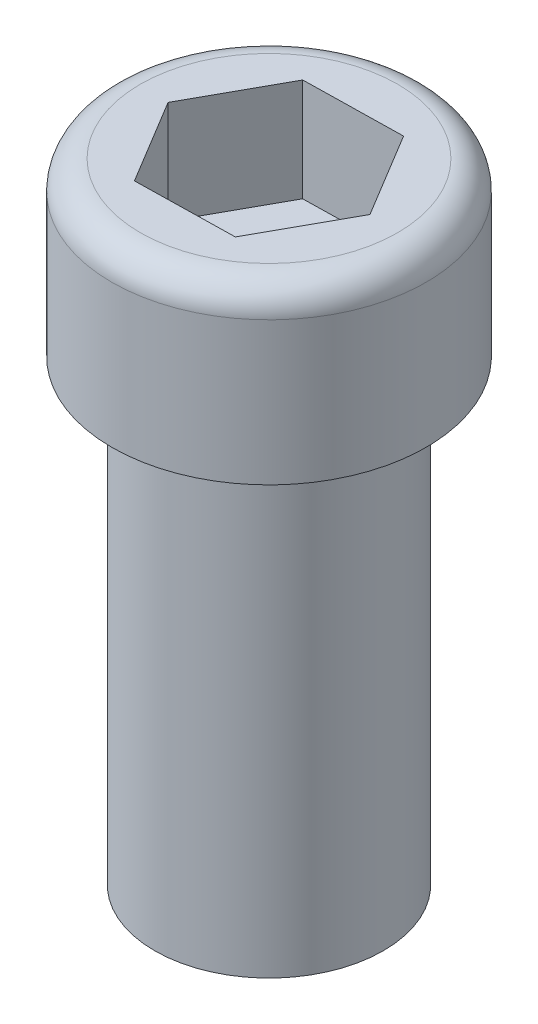
from build123d import *

# Parameters (mm, degrees)
SKETCH1_R           = 2
BOSS_EXTRUDE1_DEPTH = 8
SKETCH2_R           = 2.75
BOSS_EXTRUDE2_DEPTH = 3
CUT_EXTRUDE1_DEPTH  = 1.8
FILLET1_R           = 0.5


with BuildPart() as part:
    # Sketch1 → Boss-Extrude1 (new body)
    with BuildSketch(Plane(origin=(0, 0, 0), x_dir=(1, 0, 0), z_dir=(0, 1, 0))):
        with Locations(Location((0, 0, 0), (0, 0, 270))):
            Circle(SKETCH1_R)
    extrude(amount=BOSS_EXTRUDE1_DEPTH)

    # Sketch2 → Boss-Extrude2 (add)
    with BuildSketch(Plane(origin=(0, 8, 0), x_dir=(1, 0, 0), z_dir=(0, 1, 0))):
        with Locations(Location((0, 0, 0), (0, 0, 270))):
            Circle(SKETCH2_R)
    extrude(amount=BOSS_EXTRUDE2_DEPTH)

    # Sketch3 → Cut-Extrude1 (cut)
    with BuildSketch(Plane(origin=(0, 11, 0), x_dir=(1, 0, 0), z_dir=(0, 1, 0))):
        Polygon((0.837254289, 1.516247096), (-0.894481359, 1.483207031), (-1.731735648, -0.033040065), (-0.837254289, -1.516247096), (0.894481359, -1.483207031), (1.731735648, 0.033040065), align=None)
    extrude(amount=-CUT_EXTRUDE1_DEPTH, mode=Mode.SUBTRACT)

    # Fillet1
    fillet1_edges = [part.edges().sort_by_distance(p)[0] for p in [
        (0, 11, -2.75),
    ]]
    fillet(fillet1_edges, radius=FILLET1_R)


solid = part.part
